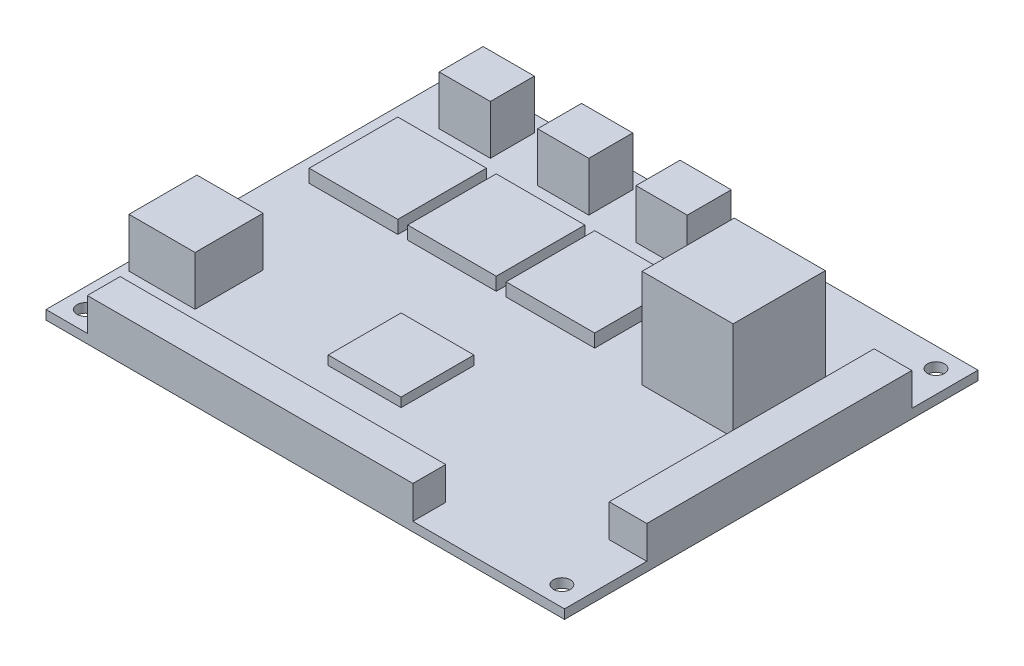
from build123d import *

# Parameters (mm, degrees)
SKETCH1_W                 = 100.33
SKETCH1_H                 = 80.01
BOSS_EXTRUDE1_DEPTH       = 1.778
F_4_CLEARANCE_HOLE1_D     = 3.2639
F_4_CLEARANCE_HOLE1_DEPTH = 12.7
F_4_CLEARANCE_HOLE1_TIP   = 0.980574487
SKETCH4_W                 = 17.145
SKETCH4_H                 = 17.145
BOSS_EXTRUDE2_DEPTH       = 2.54
SKETCH6_W                 = 9.906
SKETCH6_H                 = 8.509
BOSS_EXTRUDE3_DEPTH       = 9.525
LPATTERN1_COUNT           = 3
LPATTERN1_PITCH           = 19.05
SKETCH7_W                 = 14.097
SKETCH7_H                 = 14.097
BOSS_EXTRUDE4_DEPTH       = 1.778
SKETCH8_W                 = 62.992
SKETCH8_H                 = 6.35
BOSS_EXTRUDE5_DEPTH       = 6.35
SKETCH9_W                 = 7.270390316
SKETCH9_H                 = 51.271334807
BOSS_EXTRUDE6_DEPTH       = 6.35
SKETCH10_W                = 17.620008018
SKETCH10_H                = 17.836647461
BOSS_EXTRUDE7_DEPTH       = 19.05
SKETCH11_W                = 12.792637694
SKETCH11_H                = 13.15401164
BOSS_EXTRUDE8_DEPTH       = 9.525


with BuildPart() as part:
    # Sketch1 → Boss-Extrude1 (new body)
    with BuildSketch(Plane(origin=(0, 0, 0), x_dir=(1, 0, 0), z_dir=(0, 1, 0))):
        Rectangle(SKETCH1_W, SKETCH1_H)
    extrude(amount=BOSS_EXTRUDE1_DEPTH)

    # #4 Clearance Hole1
    with Locations(Plane(origin=(0, 1.778, 0), x_dir=(1, 0, 0), z_dir=(0, 1, 0))):
        with Locations((-46.355, 36.195), (45.847, -36.195), (-46.355, -36.195), (45.847, 36.195)):
            Hole(F_4_CLEARANCE_HOLE1_D / 2, depth=F_4_CLEARANCE_HOLE1_DEPTH)
            with Locations((0, 0, -(F_4_CLEARANCE_HOLE1_DEPTH + F_4_CLEARANCE_HOLE1_TIP / 2))):  # 118° drill point
                Cone(0, F_4_CLEARANCE_HOLE1_D / 2, F_4_CLEARANCE_HOLE1_TIP, mode=Mode.SUBTRACT)

    # Sketch4 → Boss-Extrude2 (add)
    with BuildSketch(Plane(origin=(0, 1.778, 0), x_dir=(1, 0, 0), z_dir=(0, 1, 0))):
        with Locations((-37.2745, 15.1765)):
            Rectangle(SKETCH4_W, SKETCH4_H)
    boss_extrude2 = extrude(amount=BOSS_EXTRUDE2_DEPTH)

    # Sketch6 → Boss-Extrude3 (add)
    with BuildSketch(Plane(origin=(0, 1.778, 0), x_dir=(1, 0, 0), z_dir=(0, 1, 0))):
        with Locations((-37.465, 32.5755)):
            Rectangle(SKETCH6_W, SKETCH6_H)
    boss_extrude3 = extrude(amount=BOSS_EXTRUDE3_DEPTH)

    # LPattern1: Boss-Extrude2, Boss-Extrude3 ×3
    with Locations(*[(i * LPATTERN1_PITCH, 0, 0) for i in range(1, LPATTERN1_COUNT)]):
        add(boss_extrude2)
        add(boss_extrude3)

    # Sketch7 → Boss-Extrude4 (add)
    with BuildSketch(Plane(origin=(0, 1.778, 0), x_dir=(1, 0, 0), z_dir=(0, 1, 0))):
        with Locations((-6.4135, -15.0495)):
            Rectangle(SKETCH7_W, SKETCH7_H)
    extrude(amount=BOSS_EXTRUDE4_DEPTH)

    # Sketch8 → Boss-Extrude5 (add)
    with BuildSketch(Plane(origin=(0, 1.778, 0), x_dir=(1, 0, 0), z_dir=(0, 1, 0))):
        with Locations((-10.668, -36.83)):
            Rectangle(SKETCH8_W, SKETCH8_H)
    extrude(amount=BOSS_EXTRUDE5_DEPTH)

    # Sketch9 → Boss-Extrude6 (add)
    with BuildSketch(Plane(origin=(0, 1.778, 0), x_dir=(1, 0, 0), z_dir=(0, 1, 0))):
        with Locations((46.529804842, 1.552582673)):
            Rectangle(SKETCH9_W, SKETCH9_H)
    extrude(amount=BOSS_EXTRUDE6_DEPTH)

    # Sketch10 → Boss-Extrude7 (add)
    with BuildSketch(Plane(origin=(0, 1.778, 0), x_dir=(1, 0, 0), z_dir=(0, 1, 0))):
        with Locations((28.957472194, 13.93713749)):
            Rectangle(SKETCH10_W, SKETCH10_H)
    extrude(amount=BOSS_EXTRUDE7_DEPTH)

    # Sketch11 → Boss-Extrude8 (add)
    with BuildSketch(Plane(origin=(0, 1.778, 0), x_dir=(1, 0, 0), z_dir=(0, 1, 0))):
        with Locations((-42.172339514, -18.972132172)):
            Rectangle(SKETCH11_W, SKETCH11_H)
    extrude(amount=BOSS_EXTRUDE8_DEPTH)


solid = part.part
